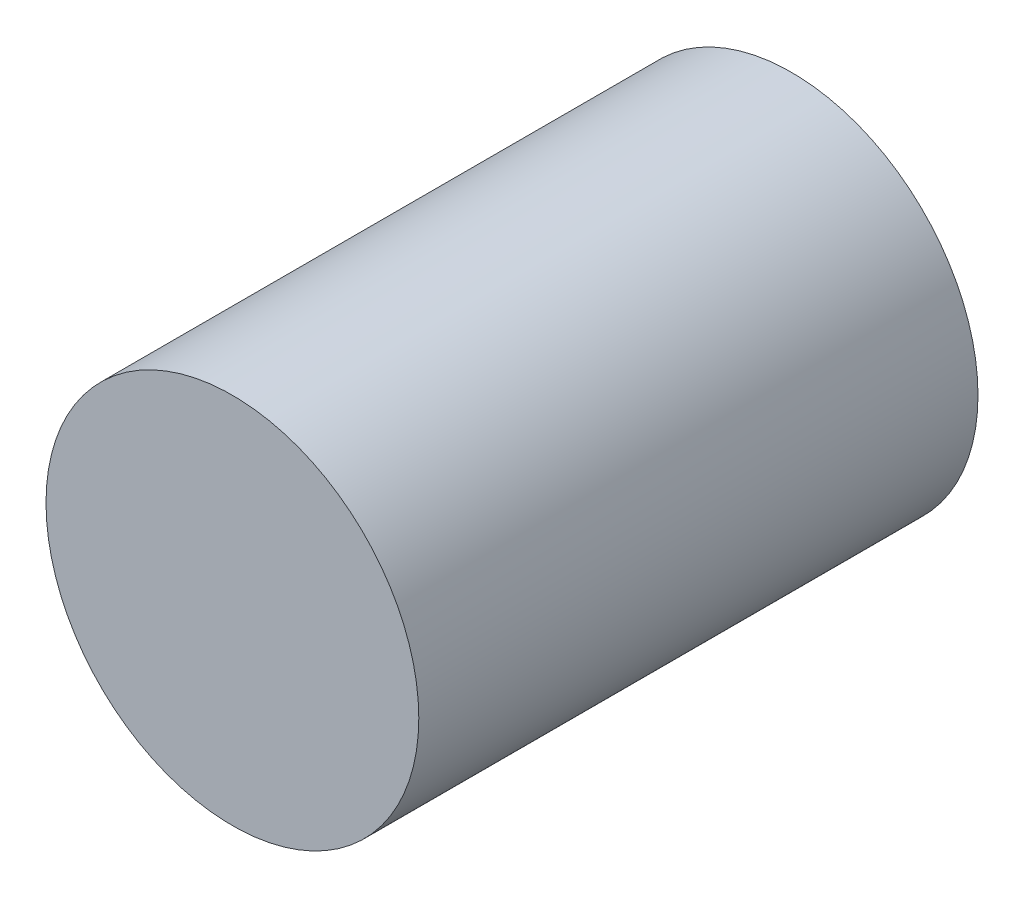
from build123d import *

# Parameters (mm, degrees)
SKETCH_1_R      = 10
EXTRUDE_1_DEPTH = 30


with BuildPart() as part:
    # Эскиз1 → Бобышка-Вытянуть1 (new body)
    with BuildSketch(Plane.XY):
        Circle(SKETCH_1_R)
    extrude(amount=EXTRUDE_1_DEPTH)


solid = part.part
